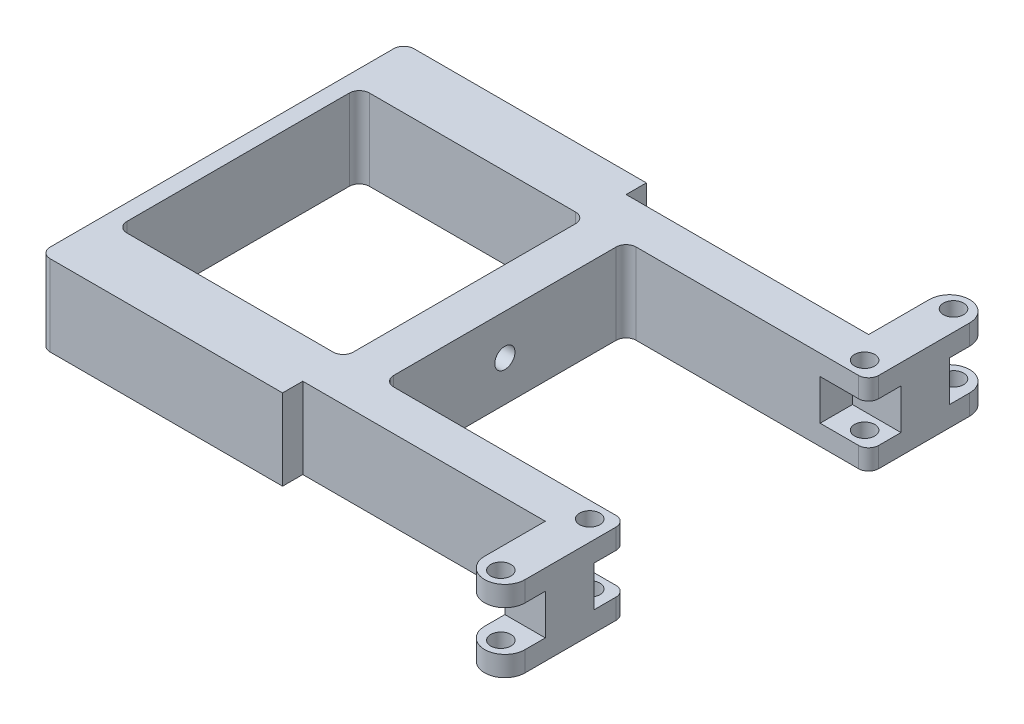
from build123d import *

# Parameters (mm, degrees)
SKETCH1_W           = 60
SKETCH1_H           = 90
BOSS_EXTRUDE1_DEPTH = 20
EXTRUDE_THIN2_DEPTH = 20
SKETCH4_W           = 52
SKETCH4_H           = 60
CUT_EXTRUDE1_DEPTH  = 20
SKETCH5_W           = 4
SKETCH5_H           = 60
CUT_EXTRUDE2_DEPTH  = 20
SKETCH6_R           = 2.5
CUT_EXTRUDE5_DEPTH  = 20
SKETCH8_R           = 2.5
CUT_EXTRUDE6_DEPTH  = 20
FILLET1_R           = 2.5
SKETCH10_R          = 2.5
CUT_EXTRUDE8_DEPTH  = 20
FILLET4_RADIUS      = 5
FILLET4_LENGTH      = 20
FILLET5_RADIUS      = 5
FILLET5_LENGTH      = 20
FILLET7_R           = 2.5
SKETCH14_W          = 10
SKETCH14_H          = 10
SKETCH14_W_2        = 12
SKETCH14_H_2        = 8
CUT_EXTRUDE12_DEPTH = 5


with BuildPart() as part:
    # Sketch1 → Boss-Extrude1 (new body)
    with BuildSketch(Plane(origin=(0, 0, 0), x_dir=(1, 0, 0), z_dir=(0, 1, 0))):
        Rectangle(SKETCH1_W, SKETCH1_H)
    extrude(amount=BOSS_EXTRUDE1_DEPTH)

    # Sketch2 → Extrude-Thin2 (add)
    with BuildSketch(Plane(origin=(0, 20, 0), x_dir=(1, 0, 0), z_dir=(0, 1, 0))):
        Polygon((90, -60), (90, -40), (30, -40), (30, 0), (30, 40), (90, 40), (90, 60), (100, 60), (100, 30), (40, 30), (40, 0), (40, -30), (100, -30), (100, -60), align=None)
    extrude(amount=-EXTRUDE_THIN2_DEPTH)

    # Sketch4 → Cut-Extrude1 (cut)
    with BuildSketch(Plane(origin=(0, 20, 0), x_dir=(1, 0, 0), z_dir=(0, 1, 0))):
        Rectangle(SKETCH4_W, SKETCH4_H)
    extrude(amount=-CUT_EXTRUDE1_DEPTH, mode=Mode.SUBTRACT)

    # Sketch5 → Cut-Extrude2 (cut)
    with BuildSketch(Plane(origin=(0, 20, 0), x_dir=(1, 0, 0), z_dir=(0, 1, 0))):
        with Locations((28, 0)):
            Rectangle(SKETCH5_W, SKETCH5_H)
    extrude(amount=-CUT_EXTRUDE2_DEPTH, mode=Mode.SUBTRACT)

    # Sketch6 → Cut-Extrude5 (cut, symmetric)
    with BuildSketch(Plane(origin=(0, 10, 0), x_dir=(1, 0, 0), z_dir=(0, 1, 0))):
        with Locations(Location((95, -34, 0), (0, 0, 270))):
            Circle(SKETCH6_R)
    cut_extrude5 = extrude(amount=CUT_EXTRUDE5_DEPTH, both=True, mode=Mode.SUBTRACT)

    # Sketch8 → Cut-Extrude6 (cut, symmetric)
    with BuildSketch(Plane(origin=(0, 10, 0), x_dir=(1, 0, 0), z_dir=(0, 1, 0))):
        with Locations(Location((95, -56, 0), (0, 0, 270))):
            Circle(SKETCH8_R)
    cut_extrude6 = extrude(amount=CUT_EXTRUDE6_DEPTH, both=True, mode=Mode.SUBTRACT)

    # Mirror1: Cut-Extrude5, Cut-Extrude6 across plane
    add(cut_extrude5.mirror(Plane.XY), mode=Mode.SUBTRACT)
    add(cut_extrude6.mirror(Plane.XY), mode=Mode.SUBTRACT)

    # Fillet1
    fillet1_edges = [part.edges().sort_by_distance(p)[0] for p in [
        (40, 10, -30),
        (40, 10, 30),
        (-26, 10, 30),
        (-26, 10, -30),
        (30, 10, -30),
        (30, 10, 30),
        (-30, 10, -45),
        (-30, 10, 45),
    ]]
    fillet(fillet1_edges, radius=FILLET1_R)

    # Sketch10 → Cut-Extrude8 (cut)
    with BuildSketch(Plane(origin=(40, 0, 0), x_dir=(0, 0, -1), z_dir=(1, 0, 0))):
        with Locations((0, 10)):
            Circle(SKETCH10_R)
    extrude(amount=-CUT_EXTRUDE8_DEPTH, mode=Mode.SUBTRACT)

    # Fillet4: full round fillet: the end face becomes a half cylinder, R = half its width
    fillet4_face = Plane((95, 10, 60), x_dir=(0, 1, 0), z_dir=(0, 0, 1))  # on the end face: x along it, z out of the body
    fillet4_slab = fillet4_face.offset(-FILLET4_RADIUS / 2) * Box(FILLET4_LENGTH, 2 * FILLET4_RADIUS, FILLET4_RADIUS, mode=Mode.PRIVATE)  # the body's end, R deep
    fillet4_round = Plane((95, 10, 55), x_dir=(0, 0, 1), z_dir=(0, 1, 0)) * Cylinder(FILLET4_RADIUS, FILLET4_LENGTH, mode=Mode.PRIVATE)  # its axis R under the face
    add(fillet4_slab - fillet4_round, mode=Mode.SUBTRACT)

    # Fillet5: full round fillet: the end face becomes a half cylinder, R = half its width
    fillet5_face = Plane((95, 10, -60), x_dir=(0, -1, 0), z_dir=(0, 0, -1))  # on the end face: x along it, z out of the body
    fillet5_slab = fillet5_face.offset(-FILLET5_RADIUS / 2) * Box(FILLET5_LENGTH, 2 * FILLET5_RADIUS, FILLET5_RADIUS, mode=Mode.PRIVATE)  # the body's end, R deep
    fillet5_round = Plane((95, 10, -55), x_dir=(0, 0, -1), z_dir=(0, -1, 0)) * Cylinder(FILLET5_RADIUS, FILLET5_LENGTH, mode=Mode.PRIVATE)  # its axis R under the face
    add(fillet5_slab - fillet5_round, mode=Mode.SUBTRACT)

    # Fillet7
    fillet7_edges = [part.edges().sort_by_distance(p)[0] for p in [
        (100, 10, -30),
        (100, 10, 30),
    ]]
    fillet(fillet7_edges, radius=FILLET7_R)

    # Sketch14 → Cut-Extrude12 (cut, symmetric)
    with BuildSketch(Plane(origin=(0, 10, 0), x_dir=(1, 0, 0), z_dir=(0, 1, 0))):
        with Locations((95, 55)):
            Rectangle(SKETCH14_W, SKETCH14_H)
        with Locations((94, 34)):
            Rectangle(SKETCH14_W_2, SKETCH14_H_2)
    cut_extrude12 = extrude(amount=CUT_EXTRUDE12_DEPTH, both=True, mode=Mode.SUBTRACT)

    # Mirror3: Cut-Extrude12 across plane
    add(cut_extrude12.mirror(Plane.XY), mode=Mode.SUBTRACT)


solid = part.part
